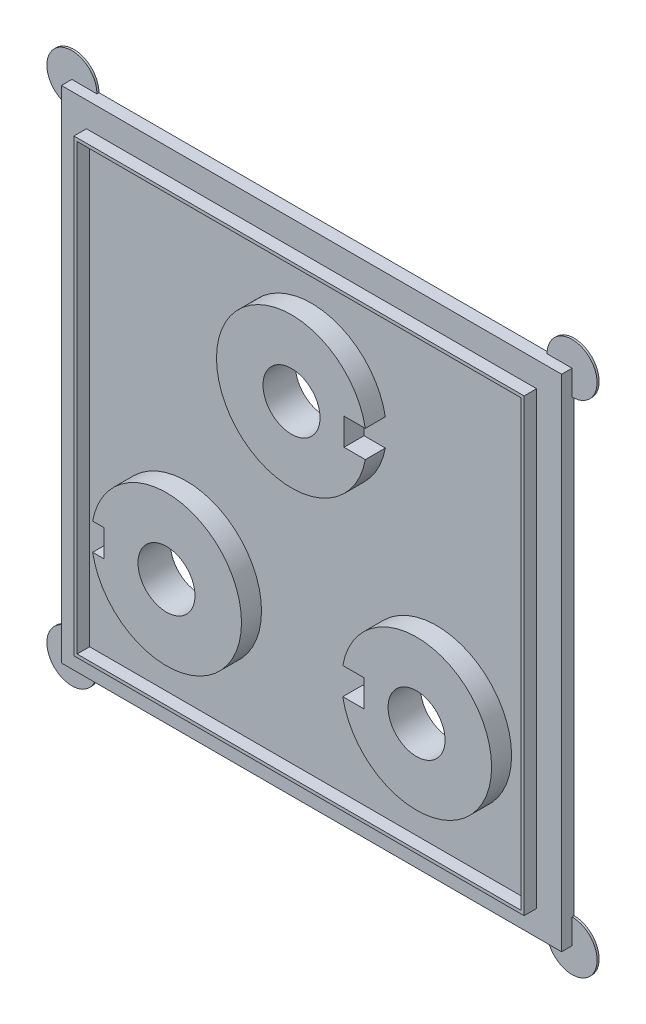
from build123d import *

# Parameters (mm, degrees)
SKETCH1_W           = 63.5
SKETCH1_H           = 63.5
BOSS_EXTRUDE1_DEPTH = 1.5875
SKETCH2_W           = 57.15
SKETCH2_H           = 57.15
SKETCH2_W_2         = 56.35
SKETCH2_H_2         = 56.35
BOSS_EXTRUDE2_DEPTH = 1.5875
SKETCH3_R           = 9.525
BOSS_EXTRUDE4_DEPTH = 2.54
SKETCH5_R           = 3.6195
CUT_EXTRUDE2_DEPTH  = 46.090589442
SKETCH6_W           = 3.175
SKETCH6_H           = 3.429
CUT_EXTRUDE3_DEPTH  = 2.54
SKETCH7_R           = 3.175
BOSS_EXTRUDE5_DEPTH = 0.26


with BuildPart() as part:
    # Sketch1 → Boss-Extrude1 (new body)
    with BuildSketch(Plane.XY):
        Rectangle(SKETCH1_W, SKETCH1_H)
    extrude(amount=BOSS_EXTRUDE1_DEPTH)

    # Sketch2 → Boss-Extrude2 (add)
    with BuildSketch(Plane.XY.offset(1.5875)):
        Rectangle(SKETCH2_W, SKETCH2_H)
        Rectangle(SKETCH2_W_2, SKETCH2_H_2, mode=Mode.SUBTRACT)
    extrude(amount=BOSS_EXTRUDE2_DEPTH)

    # Sketch3 → Boss-Extrude4 (add)
    with BuildSketch(Plane.XY.offset(1.5875)):
        with Locations(Location((-15.875, -13.335, 0), (0, 0, 180))):
            Circle(SKETCH3_R)
        with Locations(Location((0, 14.16130657, 0), (0, 0, 180))):
            Circle(SKETCH3_R)
        with Locations(Location((15.875, -13.335, 0), (0, 0, 180))):
            Circle(SKETCH3_R)
    extrude(amount=BOSS_EXTRUDE4_DEPTH)

    # Sketch5 → Cut-Extrude2 (cut, through all)
    with BuildSketch(Plane.XY.offset(4.1275)):
        with Locations((0, 14.16130657)):
            Circle(SKETCH5_R)
        with Locations((15.875, -13.335)):
            Circle(SKETCH5_R)
        with Locations((-15.875, -13.335)):
            Circle(SKETCH5_R)
    extrude(amount=-CUT_EXTRUDE2_DEPTH, mode=Mode.SUBTRACT)

    # Sketch6 → Cut-Extrude3 (cut)
    with BuildSketch(Plane.XY.offset(4.1275)):
        with Locations((8.255, 14.16130657)):
            Rectangle(SKETCH6_W, SKETCH6_H)
        with Locations((-25.4, -13.335)):
            Rectangle(SKETCH6_W, SKETCH6_H)
        with Locations((7.62, -13.335)):
            Rectangle(SKETCH6_W, SKETCH6_H)
    extrude(amount=-CUT_EXTRUDE3_DEPTH, mode=Mode.SUBTRACT)

    # Sketch7 → Boss-Extrude5 (add)
    with BuildSketch(Plane(origin=(0, 0, 0), x_dir=(-1, 0, 0), z_dir=(0, 0, -1))):
        with Locations((31.75, -31.75)):
            Circle(SKETCH7_R)
        with Locations((-31.75, -31.75)):
            Circle(SKETCH7_R)
        with Locations((-31.75, 31.75)):
            Circle(SKETCH7_R)
        with Locations((31.75, 31.75)):
            Circle(SKETCH7_R)
    extrude(amount=-BOSS_EXTRUDE5_DEPTH)


solid = part.part
